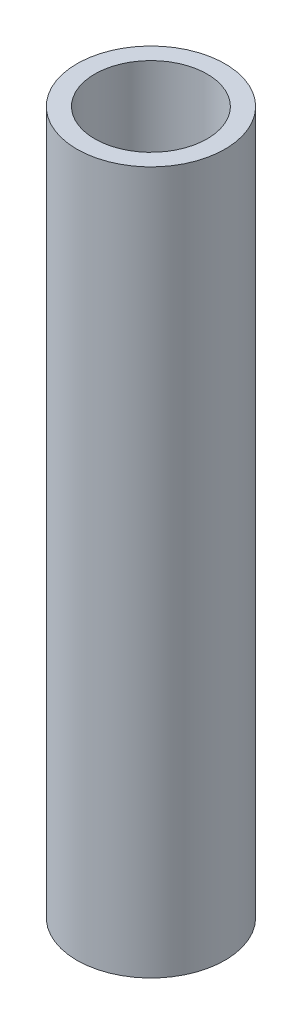
from build123d import *

# Parameters (mm, degrees)
SKETCH1_R           = 1.054
SKETCH1_R_2         = 0.8
BOSS_EXTRUDE1_DEPTH = 10


with BuildPart() as part:
    # Sketch1 → Boss-Extrude1 (new body)
    with BuildSketch(Plane(origin=(0, 0, 0), x_dir=(1, 0, 0), z_dir=(0, 1, 0))):
        with Locations(Location((0, 0, 0), (0, 0, 270))):
            Circle(SKETCH1_R)
        with Locations(Location((0, 0, 0), (0, 0, 270))):
            Circle(SKETCH1_R_2, mode=Mode.SUBTRACT)
    extrude(amount=BOSS_EXTRUDE1_DEPTH)


solid = part.part
